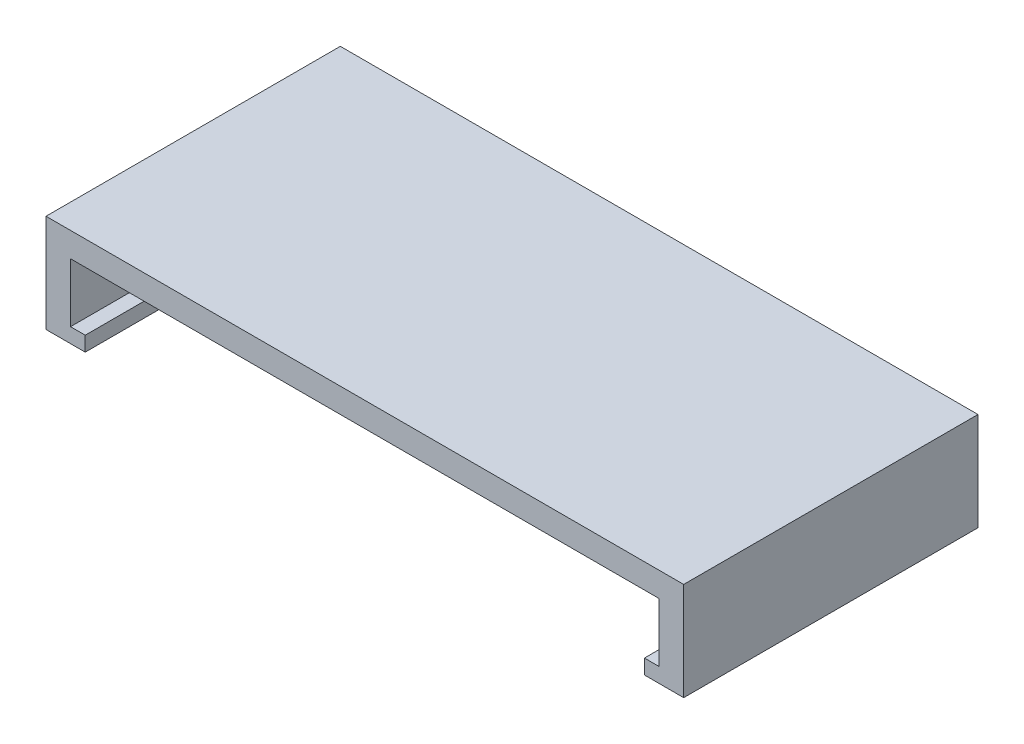
from build123d import *

# Parameters (mm, degrees)
EXTRUDE_1_DEPTH = 30


with BuildPart() as part:
    # 스케치1 → 보스-돌출1 (new body)
    with BuildSketch(Plane.XY):
        Polygon((2.5, 7.5), (28.063202842, 7.5), (37.280706614, 7.5), (62.5, 7.5), (62.5, 1.5), (61, 1.5), (61, 0), (65, 0), (65, 1.5), (65, 10), (0, 10), (0, 1.5), (0, 0), (4, 0), (4, 1.5), (2.5, 1.5), align=None)
    extrude(amount=EXTRUDE_1_DEPTH)


solid = part.part
